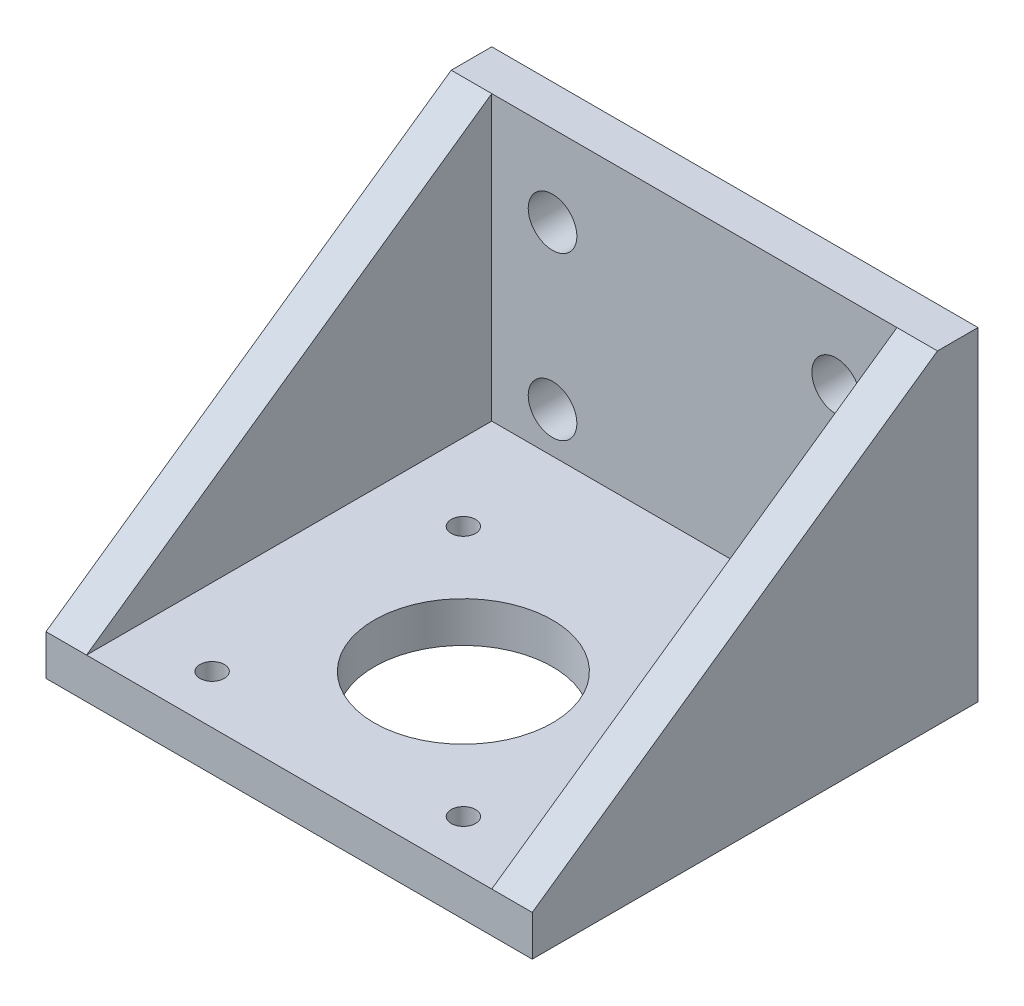
from build123d import *

# Parameters (mm, degrees)
SKETCH_1_W          = 60
SKETCH_1_H          = 55
SKETCH_1_R          = 11
SKETCH_1_R_2        = 1.5
EXTRUDE_1_DEPTH     = 5
EXTRUDE_2_DEPTH     = 35
SKETCH_4_R          = 3
CUT_EXTRUDE_1_DEPTH = 5
CUT_EXTRUDE_2_REACH = 92.692


with BuildPart() as part:
    # Эскиз1 → Бобышка-Вытянуть1 (new body)
    with BuildSketch(Plane(origin=(0, 0, 0), x_dir=(1, 0, 0), z_dir=(0, 1, 0))):
        with Locations((30, 27.5)):
            Rectangle(SKETCH_1_W, SKETCH_1_H)
        with Locations(Location((30, 21.5, 0), (0, 0, 270))):
            Circle(SKETCH_1_R, mode=Mode.SUBTRACT)
        with Locations(Location((14.5, 37, 0), (0, 0, 270))):
            Circle(SKETCH_1_R_2, mode=Mode.SUBTRACT)
        with Locations(Location((45.5, 37, 0), (0, 0, 270))):
            Circle(SKETCH_1_R_2, mode=Mode.SUBTRACT)
        with Locations(Location((45.5, 6, 0), (0, 0, 270))):
            Circle(SKETCH_1_R_2, mode=Mode.SUBTRACT)
        with Locations(Location((14.5, 6, 0), (0, 0, 270))):
            Circle(SKETCH_1_R_2, mode=Mode.SUBTRACT)
    extrude(amount=EXTRUDE_1_DEPTH)

    # Эскиз3 → Бобышка-Вытянуть2 (add)
    with BuildSketch(Plane(origin=(0, 5, 0), x_dir=(1, 0, 0), z_dir=(0, 1, 0))):
        Polygon((5, 50), (55, 50), (55, 0), (60, 0), (60, 55), (0, 55), (0, 0), (5, 0), align=None)
    extrude(amount=EXTRUDE_2_DEPTH)

    # Эскиз4 → Вырез-Вытянуть1 (cut)
    with BuildSketch(Plane(origin=(0, 0, -55), x_dir=(-1, 0, 0), z_dir=(0, 0, -1))):
        with Locations((-12.5, 10)):
            Circle(SKETCH_4_R)
        with Locations((-12.5, 30)):
            Circle(SKETCH_4_R)
        with Locations((-47.5, 30)):
            Circle(SKETCH_4_R)
        with Locations((-47.5, 10)):
            Circle(SKETCH_4_R)
    extrude(amount=-CUT_EXTRUDE_1_DEPTH, mode=Mode.SUBTRACT)

    # Вырез-Вытянуть2: up to this face of the body (flat: up to its plane)
    cut_extrude_2_end = Plane(part.part.faces().sort_by_distance((60, 20, -27.5))[0])
    # Эскиз5 → Вырез-Вытянуть2 (cut, up to the picked face)
    with BuildSketch(Plane.ZY, mode=Mode.PRIVATE) as cut_extrude_2_sk1:
        Polygon((0, 5), (-50, 40), (0, 40), align=None)
    cut_extrude_2_tool1 = split(extrude(cut_extrude_2_sk1.sketch, amount=-CUT_EXTRUDE_2_REACH, mode=Mode.PRIVATE), bisect_by=cut_extrude_2_end, keep=Keep.BOTH, mode=Mode.PRIVATE)
    add(cut_extrude_2_tool1.solids().sort_by(Axis((0, 28.333333, -16.666667), (1, 0, 0)))[0], mode=Mode.SUBTRACT)


solid = part.part
